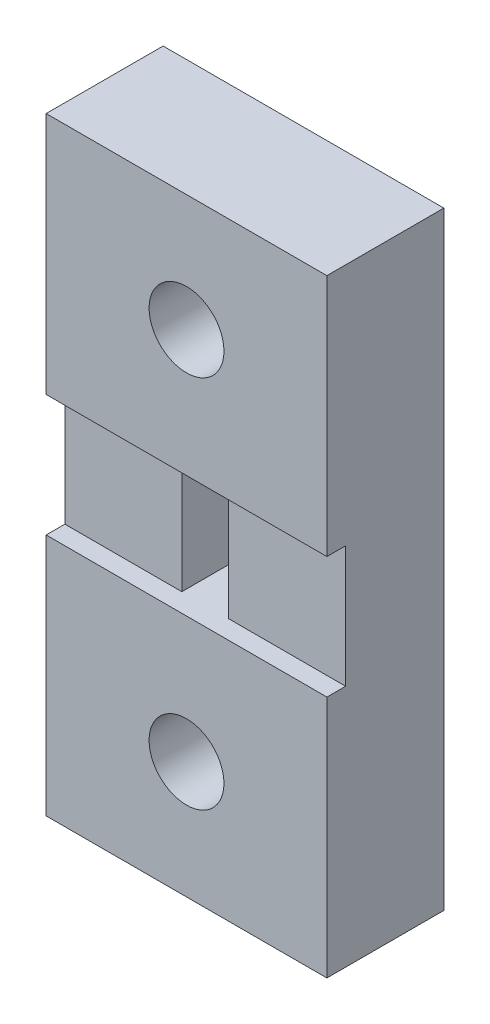
from build123d import *

# Parameters (mm, degrees)
SKETCH1_W           = 12
SKETCH1_H           = 26
SKETCH1_R           = 1.6
SKETCH1_W_2         = 2
SKETCH1_H_2         = 5.2
BOSS_EXTRUDE1_DEPTH = 5
SKETCH3_W           = 12
SKETCH3_H           = 5.2
CUT_EXTRUDE1_DEPTH  = 0.8
CUT_EXTRUDE2_DEPTH  = 2.5


with BuildPart() as part:
    # Sketch1 → Boss-Extrude1 (new body)
    with BuildSketch(Plane.XY):
        Rectangle(SKETCH1_W, SKETCH1_H)
        with Locations((0, 8)):
            Circle(SKETCH1_R, mode=Mode.SUBTRACT)
        with Locations((0, -8)):
            Circle(SKETCH1_R, mode=Mode.SUBTRACT)
        Rectangle(SKETCH1_W_2, SKETCH1_H_2, mode=Mode.SUBTRACT)
    extrude(amount=BOSS_EXTRUDE1_DEPTH)

    # Sketch3 → Cut-Extrude1 (cut)
    with BuildSketch(Plane.XY.offset(5)):
        Rectangle(SKETCH3_W, SKETCH3_H)
    extrude(amount=-CUT_EXTRUDE1_DEPTH, mode=Mode.SUBTRACT)

    # Sketch4 → Cut-Extrude2 (cut)
    with BuildSketch(Plane(origin=(0, 0, 0), x_dir=(-1, 0, 0), z_dir=(0, 0, -1))):
        Polygon((1.732050808, 11), (-1.732050808, 11), (-3.464101615, 8), (-1.732050808, 5), (1.732050808, 5), (3.464101615, 8), align=None)
        Polygon((1.732050808, -5), (-1.732050808, -5), (-3.464101615, -8), (-1.732050808, -11), (1.732050808, -11), (3.464101615, -8), align=None)
    extrude(amount=-CUT_EXTRUDE2_DEPTH, mode=Mode.SUBTRACT)


solid = part.part
